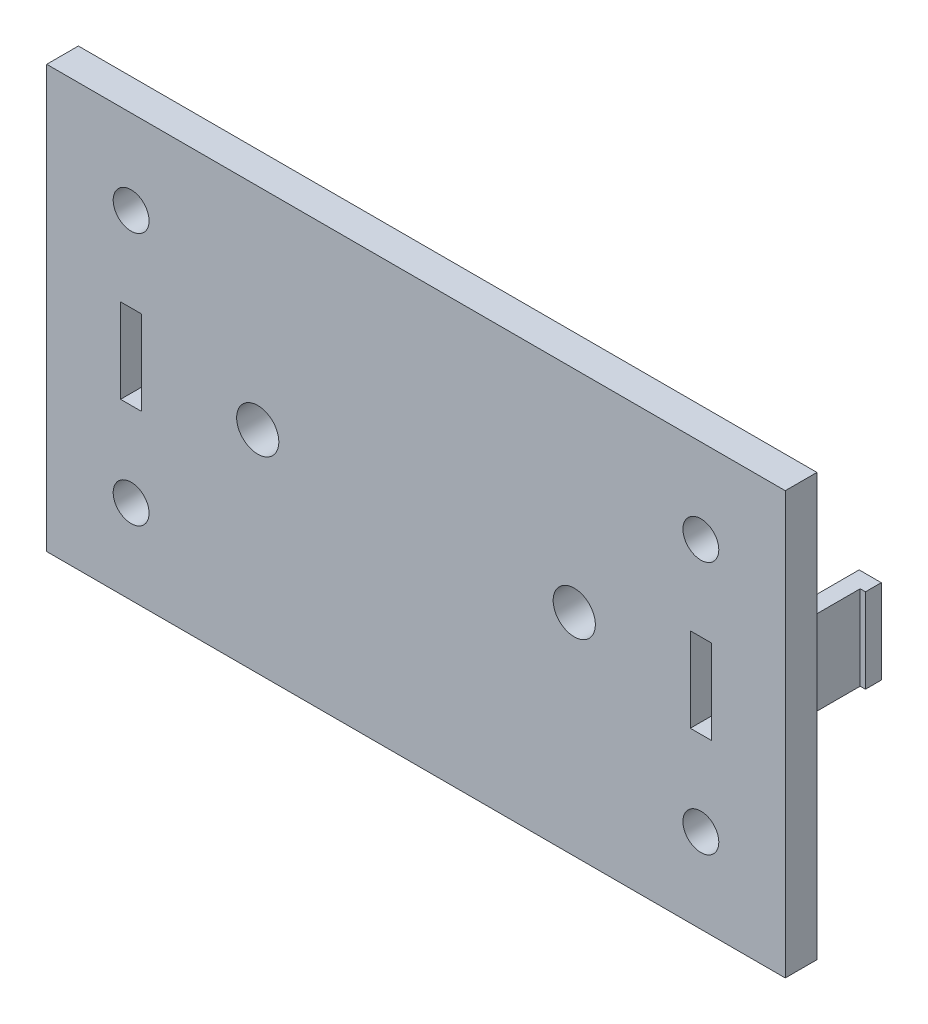
from build123d import *

# Parameters (mm, degrees)
SKETCH2_W                 = 70
SKETCH2_H                 = 40
LID_PLATE_DEPTH           = 3
SKETCH3_R                 = 2
PORT_BORE_DEPTH           = 3
SKETCH4_R                 = 2
CUT_EXTRUDE2_DEPTH        = 3
SKETCH5_R                 = 1.7
SCREW_CLEARANCE_DEPTH     = 3
SKETCH6_R                 = 1.7
CUT_EXTRUDE4_DEPTH        = 3
SKETCH7_R                 = 1.7
CUT_EXTRUDE5_DEPTH        = 3
SKETCH8_R                 = 1.7
CUT_EXTRUDE6_DEPTH        = 3
SNAP_BEAM_START           = -10
SKETCH9_W                 = 1.6
SKETCH9_H                 = 8
SNAP_BEAM_DEPTH           = 10
SNAP_HOOK_START           = -10
SKETCH10_W                = 0.5
SKETCH10_H                = 8
SNAP_HOOK_DEPTH           = 1.5
SKETCH11_W                = 2
SKETCH11_H                = 8
SNAP_RELEASE_ACCESS_DEPTH = 3
BOSS_EXTRUDE4_START       = -10
SKETCH12_W                = 1.6
SKETCH12_H                = 8
BOSS_EXTRUDE4_DEPTH       = 10
BOSS_EXTRUDE5_START       = -10
SKETCH13_W                = 0.5
SKETCH13_H                = 8
BOSS_EXTRUDE5_DEPTH       = 1.5
SKETCH14_W                = 2
SKETCH14_H                = 8
CUT_EXTRUDE8_DEPTH        = 3


with BuildPart() as part:
    # Sketch2 → Lid_plate (new body)
    with BuildSketch(Plane.XY):
        Rectangle(SKETCH2_W, SKETCH2_H)
    extrude(amount=LID_PLATE_DEPTH)

    # Sketch3 → Port_bore (cut)
    with BuildSketch(Plane.XY):
        with Locations((-15, 0)):
            Circle(SKETCH3_R)
    extrude(amount=PORT_BORE_DEPTH, mode=Mode.SUBTRACT)

    # Sketch4 → Cut-Extrude2 (cut)
    with BuildSketch(Plane.XY):
        with Locations((15, 0)):
            Circle(SKETCH4_R)
    extrude(amount=CUT_EXTRUDE2_DEPTH, mode=Mode.SUBTRACT)

    # Sketch5 → Screw_clearance (cut)
    with BuildSketch(Plane.XY):
        with Locations((-27, -12)):
            Circle(SKETCH5_R)
    extrude(amount=SCREW_CLEARANCE_DEPTH, mode=Mode.SUBTRACT)

    # Sketch6 → Cut-Extrude4 (cut)
    with BuildSketch(Plane.XY):
        with Locations((-27, 12)):
            Circle(SKETCH6_R)
    extrude(amount=CUT_EXTRUDE4_DEPTH, mode=Mode.SUBTRACT)

    # Sketch7 → Cut-Extrude5 (cut)
    with BuildSketch(Plane.XY):
        with Locations((27, -12)):
            Circle(SKETCH7_R)
    extrude(amount=CUT_EXTRUDE5_DEPTH, mode=Mode.SUBTRACT)

    # Sketch8 → Cut-Extrude6 (cut)
    with BuildSketch(Plane.XY):
        with Locations((27, 12)):
            Circle(SKETCH8_R)
    extrude(amount=CUT_EXTRUDE6_DEPTH, mode=Mode.SUBTRACT)

    # Sketch9 → Snap_beam (add)
    with BuildSketch(Plane.XY.offset(SNAP_BEAM_START)):
        with Locations((-29.8, 0)):
            Rectangle(SKETCH9_W, SKETCH9_H)
    extrude(amount=SNAP_BEAM_DEPTH)

    # Sketch10 → Snap_hook (add)
    with BuildSketch(Plane.XY.offset(SNAP_HOOK_START)):
        with Locations((-30.85, 0)):
            Rectangle(SKETCH10_W, SKETCH10_H)
    extrude(amount=SNAP_HOOK_DEPTH)

    # Sketch11 → Snap_release_access (cut)
    with BuildSketch(Plane.XY):
        with Locations((-27, 0)):
            Rectangle(SKETCH11_W, SKETCH11_H)
    extrude(amount=SNAP_RELEASE_ACCESS_DEPTH, mode=Mode.SUBTRACT)

    # Sketch12 → Boss-Extrude4 (add)
    with BuildSketch(Plane.XY.offset(BOSS_EXTRUDE4_START)):
        with Locations((29.8, 0)):
            Rectangle(SKETCH12_W, SKETCH12_H)
    extrude(amount=BOSS_EXTRUDE4_DEPTH)

    # Sketch13 → Boss-Extrude5 (add)
    with BuildSketch(Plane.XY.offset(BOSS_EXTRUDE5_START)):
        with Locations((30.85, 0)):
            Rectangle(SKETCH13_W, SKETCH13_H)
    extrude(amount=BOSS_EXTRUDE5_DEPTH)

    # Sketch14 → Cut-Extrude8 (cut)
    with BuildSketch(Plane.XY):
        with Locations((27, 0)):
            Rectangle(SKETCH14_W, SKETCH14_H)
    extrude(amount=CUT_EXTRUDE8_DEPTH, mode=Mode.SUBTRACT)


solid = part.part
